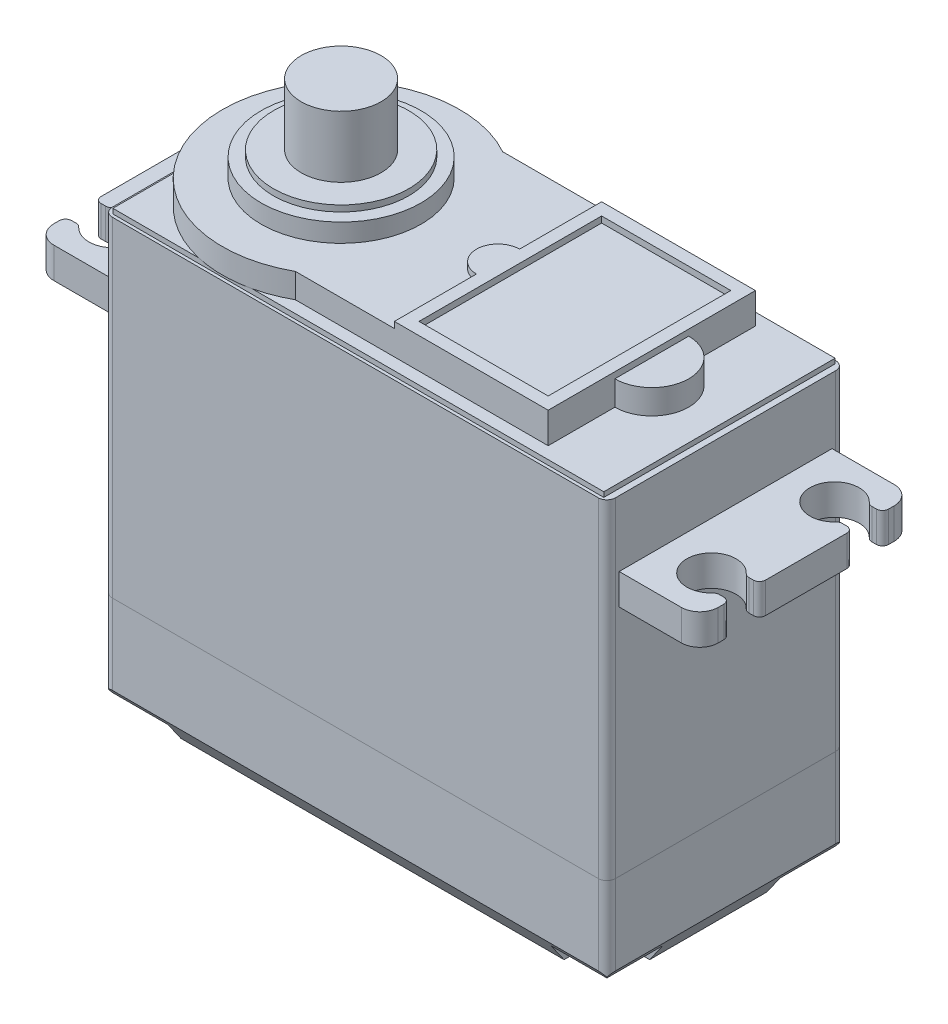
from build123d import *
from OCP.BRepFilletAPI import BRepFilletAPI_MakeChamfer

# Parameters (mm, degrees)
SKETCH1_W            = 40.9
SKETCH1_H            = 20
BOSS_EXTRUDE1_DEPTH  = 19.3
SKETCH2_W            = 40.9
SKETCH2_H            = 19.3
BOSS_EXTRUDE2_DEPTH  = 6.8
SKETCH3_W            = 40.9
SKETCH3_H            = 19.3
BOSS_EXTRUDE3_DEPTH  = 8.5
CHAMFER1_SIZE        = 2
CHAMFER1_SIZE2       = 1.400415076
CUT_EXTRUDE1_DEPTH   = 1.5
SKETCH5_W            = 39.9
SKETCH5_H            = 18.8
BOSS_EXTRUDE4_DEPTH  = 0.4
BOSS_EXTRUDE5_DEPTH  = 2
SKETCH7_R            = 6.5
BOSS_EXTRUDE6_DEPTH  = 1.5
SKETCH8_R            = 5.5
BOSS_EXTRUDE7_DEPTH  = 0.5
SKETCH9_R            = 3.25
BOSS_EXTRUDE8_DEPTH  = 5
SKETCH10_W           = 10.5
SKETCH10_H           = 14.844987384
BOSS_EXTRUDE9_DEPTH  = 0.5
FILLET1_R            = 0.7
FILLET2_R            = 0.7
FILLET3_R            = 0.7
BOSS_EXTRUDE10_START = -5.74
BOSS_EXTRUDE10_DEPTH = 2.5


with BuildPart() as part:
    # Sketch1 → Boss-Extrude1 (new body)
    with BuildSketch(Plane.XY):
        Rectangle(SKETCH1_W, SKETCH1_H)
    extrude(amount=BOSS_EXTRUDE1_DEPTH)

    # Fillet1
    fillet1_edges = [part.edges().sort_by_distance(p)[0] for p in [
        (-20.45, 0, 19.3),
        (20.45, 0, 19.3),
        (-20.45, 0, 0),
        (20.45, 0, 0),
    ]]
    fillet(fillet1_edges, radius=FILLET1_R)



with BuildPart() as body_2:
    # Sketch2 → Boss-Extrude2 (new body)
    with BuildSketch(Plane(origin=(0, 10, 0), x_dir=(1, 0, 0), z_dir=(0, 1, 0))):
        with Locations((0, -9.65)):
            Rectangle(SKETCH2_W, SKETCH2_H)
    extrude(amount=BOSS_EXTRUDE2_DEPTH)

    # Sketch5 → Boss-Extrude4 (add)
    with BuildSketch(Plane(origin=(0, 16.8, 0), x_dir=(1, 0, 0), z_dir=(0, 1, 0))):
        with Locations((0, -9.65)):
            Rectangle(SKETCH5_W, SKETCH5_H)
    extrude(amount=BOSS_EXTRUDE4_DEPTH)

    # Sketch6 → Boss-Extrude5 (add)
    with BuildSketch(Plane(origin=(0, 17.2, 0), x_dir=(1, 0, 0), z_dir=(0, 1, 0))):
        with BuildLine():
            Line((14.45, -18.072493692), (14.45, -12.65))
            ThreePointArc((14.45, -12.65), (17.45, -9.65), (14.45, -6.65))
            Line((14.45, -6.65), (14.45, -1.227506308))
            Line((14.45, -1.227506308), (-6.09, -1.227506308))
            ThreePointArc((-6.09, -1.227506308), (-20.45, -9.65), (-6.09, -18.072493692))
            Line((-6.09, -18.072493692), (14.45, -18.072493692))
        make_face()
    extrude(amount=BOSS_EXTRUDE5_DEPTH)

    # Sketch7 → Boss-Extrude6 (add)
    with BuildSketch(Plane(origin=(0, 19.2, 0), x_dir=(1, 0, 0), z_dir=(0, 1, 0))):
        with Locations(Location((-10.8, -9.65, 0), (0, 0, 270))):
            Circle(SKETCH7_R)
    extrude(amount=BOSS_EXTRUDE6_DEPTH)

    # Sketch8 → Boss-Extrude7 (add)
    with BuildSketch(Plane(origin=(0, 20.7, 0), x_dir=(1, 0, 0), z_dir=(0, 1, 0))):
        with Locations(Location((-10.8, -9.65, 0), (0, 0, 270))):
            Circle(SKETCH8_R)
    extrude(amount=BOSS_EXTRUDE7_DEPTH)

    # Sketch9 → Boss-Extrude8 (add)
    with BuildSketch(Plane(origin=(0, 21.2, 0), x_dir=(1, 0, 0), z_dir=(0, 1, 0))):
        with Locations(Location((-10.8, -9.65, 0), (0, 0, 270))):
            Circle(SKETCH9_R)
    extrude(amount=BOSS_EXTRUDE8_DEPTH)

    # Sketch10 → Boss-Extrude9 (add)
    with BuildSketch(Plane(origin=(0, 19.2, 0), x_dir=(1, 0, 0), z_dir=(0, 1, 0))):
        with BuildLine():
            Line((1.95, -1.227506308), (14.45, -1.227506308))
            Line((14.45, -1.227506308), (14.45, -18.072493692))
            Line((14.45, -18.072493692), (1.95, -18.072493692))
            Line((1.95, -18.072493692), (1.95, -11.4))
            ThreePointArc((1.95, -11.4), (0.2, -9.65), (1.95, -7.9))
            Line((1.95, -7.9), (1.95, -1.227506308))
        make_face()
        with Locations((8.2, -9.65)):
            Rectangle(SKETCH10_W, SKETCH10_H, mode=Mode.SUBTRACT)
    extrude(amount=BOSS_EXTRUDE9_DEPTH)

    # Fillet2
    fillet2_edges = [body_2.edges().sort_by_distance(p)[0] for p in [
        (20.45, 13.4, 19.3),
        (-20.45, 13.4, 19.3),
        (-20.45, 13.4, 0),
        (20.45, 13.4, 0),
    ]]
    fillet(fillet2_edges, radius=FILLET2_R)


with BuildPart() as body_3:
    # Sketch3 → Boss-Extrude3 (new body)
    with BuildSketch(Plane.XZ.offset(10)):
        with Locations((0, 9.65)):
            Rectangle(SKETCH3_W, SKETCH3_H)
    extrude(amount=BOSS_EXTRUDE3_DEPTH)

    # Chamfer1: one chamfer whose edges measure the first distance from different faces: ONE call of the kernel's chamfer builder (chamfer() names one face for all edges)
    chamfer1_edges_1 = [body_3.edges().sort_by_distance(p)[0] for p in [
        (20.45, -18.5, 9.65),
    ]]
    chamfer1_side_1 = [body_3.faces().sort_by_distance(p)[0] for p in [
        (20.45, -14.25, 9.65),
    ]]
    chamfer1_edges_2 = [body_3.edges().sort_by_distance(p)[0] for p in [
        (0, -18.5, 19.3),
    ]]
    chamfer1_side_2 = [body_3.faces().sort_by_distance(p)[0] for p in [
        (0, -14.25, 19.3),
    ]]
    chamfer1_edges_3 = [body_3.edges().sort_by_distance(p)[0] for p in [
        (-20.45, -18.5, 9.65),
    ]]
    chamfer1_side_3 = [body_3.faces().sort_by_distance(p)[0] for p in [
        (-20.45, -14.25, 9.65),
    ]]
    chamfer1_edges_4 = [body_3.edges().sort_by_distance(p)[0] for p in [
        (0, -18.5, 0),
    ]]
    chamfer1_side_4 = [body_3.faces().sort_by_distance(p)[0] for p in [
        (0, -14.25, 0),
    ]]
    chamfer1 = BRepFilletAPI_MakeChamfer(body_3.part.solid().wrapped)
    for e in chamfer1_edges_1:
        chamfer1.Add(CHAMFER1_SIZE, CHAMFER1_SIZE2, e.wrapped, chamfer1_side_1[0].wrapped)  # the first distance lies on this face
    for e in chamfer1_edges_2:
        chamfer1.Add(CHAMFER1_SIZE, CHAMFER1_SIZE2, e.wrapped, chamfer1_side_2[0].wrapped)  # the first distance lies on this face
    for e in chamfer1_edges_3:
        chamfer1.Add(CHAMFER1_SIZE, CHAMFER1_SIZE2, e.wrapped, chamfer1_side_3[0].wrapped)  # the first distance lies on this face
    for e in chamfer1_edges_4:
        chamfer1.Add(CHAMFER1_SIZE, CHAMFER1_SIZE2, e.wrapped, chamfer1_side_4[0].wrapped)  # the first distance lies on this face
    add(Compound.cast(chamfer1.Shape()), mode=Mode.REPLACE)

    # Sketch4 → Cut-Extrude1 (cut)
    with BuildSketch(Plane.XZ.offset(18.5)):
        with BuildLine():
            Line((-20.45, 19.3), (-15.57, 19.3))
            Line((-15.57, 19.3), (-15.57, 16.42))
            ThreePointArc((-15.57, 16.42), (-16.155786438, 15.005786438), (-17.57, 14.42))
            Line((-17.57, 14.42), (-20.45, 14.42))
            Line((-20.45, 14.42), (-20.45, 19.3))
        make_face()
        with BuildLine():
            Line((20.45, 14.42), (17.57, 14.42))
            ThreePointArc((17.57, 14.42), (16.155786438, 15.005786438), (15.57, 16.42))
            Line((15.57, 16.42), (15.57, 19.3))
            Line((15.57, 19.3), (20.45, 19.3))
            Line((20.45, 19.3), (20.45, 14.42))
        make_face()
        with BuildLine():
            Line((20.45, 0), (20.45, 4.88))
            Line((20.45, 4.88), (17.57, 4.88))
            ThreePointArc((17.57, 4.88), (16.155786438, 4.294213562), (15.57, 2.88))
            Line((15.57, 2.88), (15.57, 0))
            Line((15.57, 0), (20.45, 0))
        make_face()
        with BuildLine():
            Line((-20.45, 4.88), (-17.57, 4.88))
            ThreePointArc((-17.57, 4.88), (-16.155786438, 4.294213562), (-15.57, 2.88))
            Line((-15.57, 2.88), (-15.57, 0))
            Line((-15.57, 0), (-20.45, 0))
            Line((-20.45, 0), (-20.45, 4.88))
        make_face()
    extrude(amount=-CUT_EXTRUDE1_DEPTH, mode=Mode.SUBTRACT)

    # Fillet3
    fillet3_edges = [body_3.edges().sort_by_distance(p)[0] for p in [
        (-20.45, -13.25, 19.3),
        (20.45, -13.25, 19.3),
        (20.45, -13.25, 0),
        (-20.45, -13.25, 0),
    ]]
    fillet(fillet3_edges, radius=FILLET3_R)


with BuildPart() as part_1:
    add(part.part)

    add(body_2.part)  # Boss-Extrude10 merges body 2
    # Sketch11 → Boss-Extrude10 (add)
    with BuildSketch(Plane(origin=(0, 17.2, 0), x_dir=(1, 0, 0), z_dir=(0, 1, 0)).offset(BOSS_EXTRUDE10_START)):
        with BuildLine():
            Line((20.45, -1), (25.5, -1))
            ThreePointArc((25.5, -1), (26.560660172, -1.439339828), (27, -2.5))
            Line((27, -2.5), (27, -2.95))
            ThreePointArc((27, -2.95), (26.853553391, -3.303553391), (26.5, -3.45))
            Line((26.5, -3.45), (26.133030278, -3.45))
            ThreePointArc((26.133030278, -3.45), (25.933030278, -3.408257569), (25.766424222, -3.29))
            ThreePointArc((25.766424222, -3.29), (22.3, -4.65), (25.766424222, -6.01))
            ThreePointArc((25.766424222, -6.01), (25.933030278, -5.891742431), (26.133030278, -5.85))
            Line((26.133030278, -5.85), (26.5, -5.85))
            ThreePointArc((26.5, -5.85), (26.853553391, -5.996446609), (27, -6.35))
            Line((27, -6.35), (27, -12.95))
            ThreePointArc((27, -12.95), (26.853553391, -13.303553391), (26.5, -13.45))
            Line((26.5, -13.45), (26.133030278, -13.45))
            ThreePointArc((26.133030278, -13.45), (25.933030278, -13.408257569), (25.766424222, -13.29))
            ThreePointArc((25.766424222, -13.29), (22.3, -14.65), (25.766424222, -16.01))
            ThreePointArc((25.766424222, -16.01), (25.933030278, -15.891742431), (26.133030278, -15.85))
            Line((26.133030278, -15.85), (26.5, -15.85))
            ThreePointArc((26.5, -15.85), (26.853553391, -15.996446609), (27, -16.35))
            Line((27, -16.35), (27, -16.8))
            ThreePointArc((27, -16.8), (26.560660172, -17.860660172), (25.5, -18.3))
            Line((25.5, -18.3), (20.45, -18.3))
            Line((20.45, -18.3), (20.45, -1))
        make_face()
    boss_extrude10 = extrude(amount=-BOSS_EXTRUDE10_DEPTH)

    # Mirror1: Boss-Extrude10 across plane
    add(boss_extrude10.mirror(Plane(origin=(0, 0, 0), x_dir=(0, 0, 1), z_dir=(1, 0, 0))))


solid = Compound([body_3.part, part_1.part])
